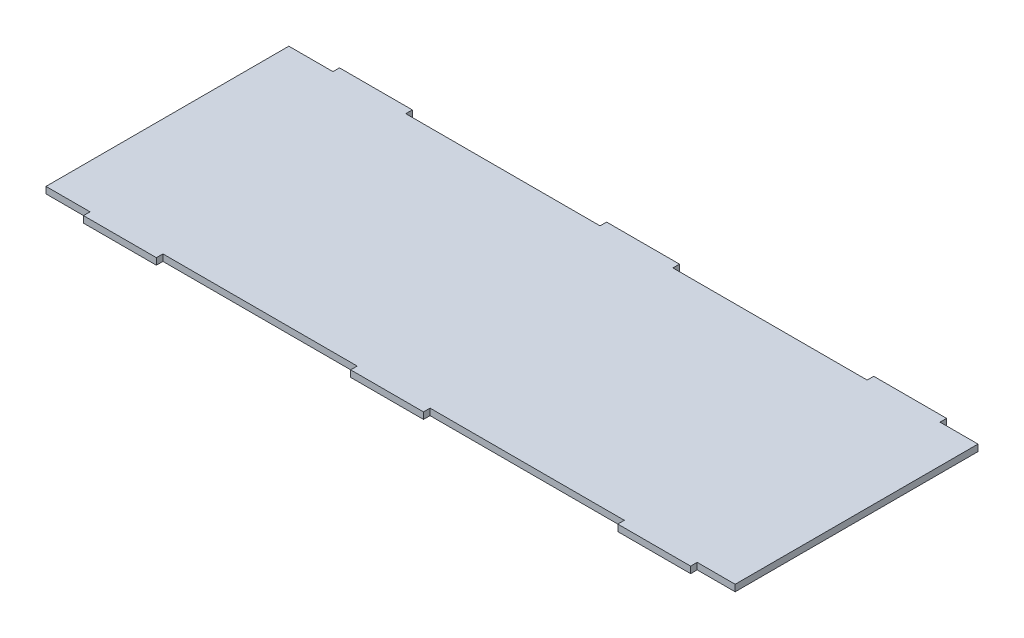
from build123d import *

# Parameters (mm, degrees)
SKETCH1_W           = 300
SKETCH1_H           = 2.7
BOSS_EXTRUDE1_DEPTH = 100
SKETCH3_W           = 30
SKETCH3_H           = 2.7
BOSS_EXTRUDE2_DEPTH = 2.7
SKETCH4_W           = 11.849818602
SKETCH4_H           = 2.7
CUT_EXTRUDE1_DEPTH  = 318.103421615
SKETCH5_W           = 4.361423596
SKETCH5_H           = 100
CUT_EXTRUDE2_DEPTH  = 2.7


with BuildPart() as part:
    # Sketch1 → Boss-Extrude1 (new body)
    with BuildSketch(Plane.XY):
        with Locations((-150, 1.35)):
            Rectangle(SKETCH1_W, SKETCH1_H)
    extrude(amount=BOSS_EXTRUDE1_DEPTH)

    # Sketch3 → Boss-Extrude2 (add)
    with BuildSketch(Plane(origin=(0, 2.7, 0), x_dir=(1, 0, 0), z_dir=(0, 1, 0))):
        with Locations((-35, 1.35)):
            Rectangle(SKETCH3_W, SKETCH3_H)
        with Locations((-145, 1.35)):
            Rectangle(SKETCH3_W, SKETCH3_H)
        with Locations((-255, 1.35)):
            Rectangle(SKETCH3_W, SKETCH3_H)
        with Locations((-255, -101.35)):
            Rectangle(SKETCH3_W, SKETCH3_H)
        with Locations((-145, -101.35)):
            Rectangle(SKETCH3_W, SKETCH3_H)
        with Locations((-35, -101.35)):
            Rectangle(SKETCH3_W, SKETCH3_H)
    extrude(amount=-BOSS_EXTRUDE2_DEPTH)

    # Sketch4 → Cut-Extrude1 (cut, through all)
    with BuildSketch(Plane(origin=(0, 0, 0), x_dir=(-1, 0, 0), z_dir=(0, 0, -1))):
        with Locations((294.075090699, 1.35)):
            Rectangle(SKETCH4_W, SKETCH4_H)
    extrude(amount=-CUT_EXTRUDE1_DEPTH, mode=Mode.SUBTRACT)

    # Sketch5 → Cut-Extrude2 (cut)
    with BuildSketch(Plane(origin=(0, 2.7, 0), x_dir=(1, 0, 0), z_dir=(0, 1, 0))):
        with Locations((-2.180711798, -50)):
            Rectangle(SKETCH5_W, SKETCH5_H)
    extrude(amount=-CUT_EXTRUDE2_DEPTH, mode=Mode.SUBTRACT)


solid = part.part
